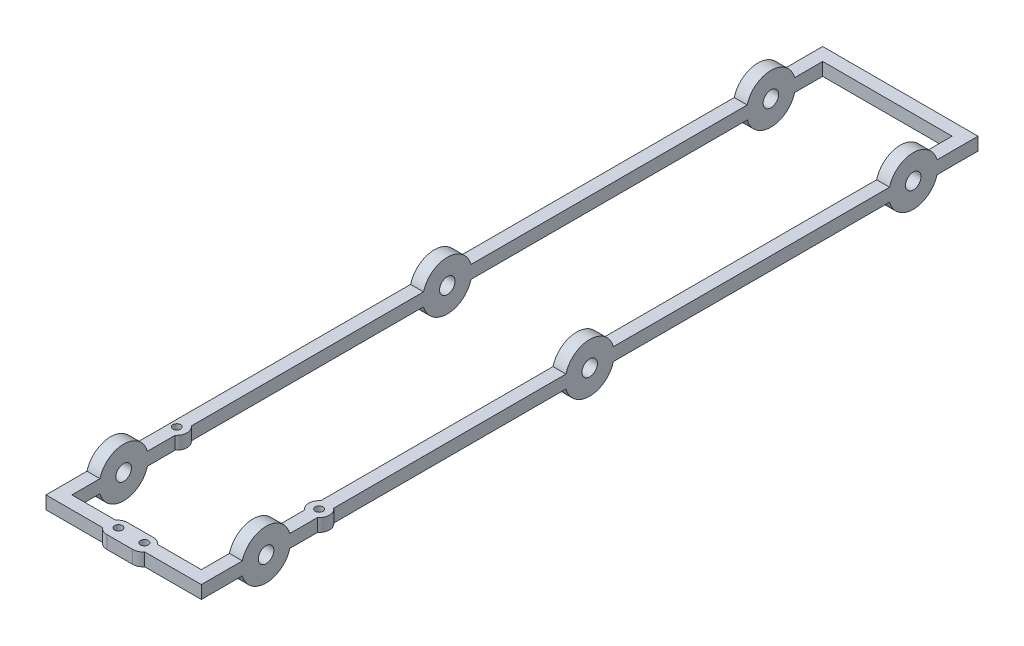
from build123d import *

# Parameters (mm, degrees)
SKETCH2_R               = 3
BOSS_EXTRUDE1_DEPTH     = 180
CUT_EXTRUDE1_DEPTH      = 351.0628515
CUT_EXTRUDE1_DEPTH_BACK = 351.0628515
SKETCH3_W               = 50
SKETCH3_H               = 290
CUT_EXTRUDE2_DEPTH      = 351.0628515
CUT_EXTRUDE2_DEPTH_BACK = 351.0628515
SKETCH5_W               = 159.12266695
SKETCH5_H               = 409.499518343
SKETCH8_R               = 4
BOSS_EXTRUDE3_DEPTH     = 5
SKETCH9_R               = 1.5
CUT_EXTRUDE4_DEPTH      = 5


with BuildPart() as part:
    # Sketch2 → Boss-Extrude1 (new body)
    with BuildSketch(Plane(origin=(0, 0, 0), x_dir=(0, 0, -1), z_dir=(1, 0, 0))):
        with BuildLine():
            Line((159.16515139, 5), (265.83484861, 5))
            ThreePointArc((265.83484861, 5), (275, 12), (284.16515139, 5))
            Line((284.16515139, 5), (300, 5))
            Line((300, 5), (300, 0))
            Line((300, 0), (284.16515139, 0))
            ThreePointArc((284.16515139, 0), (275, -7), (265.83484861, 0))
            Line((265.83484861, 0), (159.16515139, 0))
            ThreePointArc((159.16515139, 0), (150, -7), (140.83484861, 0))
            Line((140.83484861, 0), (34.16515139, 0))
            ThreePointArc((34.16515139, 0), (25, -7), (15.83484861, 0))
            Line((15.83484861, 0), (0, 0))
            Line((0, 0), (0, 5))
            Line((0, 5), (15.83484861, 5))
            ThreePointArc((15.83484861, 5), (25, 12), (34.16515139, 5))
            Line((34.16515139, 5), (140.83484861, 5))
            ThreePointArc((140.83484861, 5), (150, 12), (159.16515139, 5))
        make_face()
        with Locations(Location((150, 2.5, 0), (0, 0, 180))):
            Circle(SKETCH2_R, mode=Mode.SUBTRACT)
        with Locations(Location((275, 2.5, 0), (0, 0, 180))):
            Circle(SKETCH2_R, mode=Mode.SUBTRACT)
        with Locations(Location((25, 2.5, 0), (0, 0, 180))):
            Circle(SKETCH2_R, mode=Mode.SUBTRACT)
    extrude(amount=BOSS_EXTRUDE1_DEPTH)

    # Sketch3 → Cut-Extrude1 (cut, two sides: drawn at the far end of the back side and taken through both)
    with BuildSketch(Plane(origin=(0, 5, 0), x_dir=(1, 0, 0), z_dir=(0, 1, 0)).offset(-CUT_EXTRUDE1_DEPTH_BACK)):
        with Locations((150, 150)):
            Rectangle(SKETCH3_W, SKETCH3_H)
        with Locations((90, 150)):
            Rectangle(SKETCH3_W, SKETCH3_H)
        with Locations((30, 150)):
            Rectangle(SKETCH3_W, SKETCH3_H)
    extrude(amount=CUT_EXTRUDE1_DEPTH + CUT_EXTRUDE1_DEPTH_BACK, mode=Mode.SUBTRACT)

    # Sketch5 → Cut-Extrude2 (cut, two sides: drawn at the far end of the back side and taken through both)
    with BuildSketch(Plane(origin=(0, 5, 0), x_dir=(1, 0, 0), z_dir=(0, 1, 0)).offset(-CUT_EXTRUDE2_DEPTH_BACK)):
        with Locations((139.561333475, 139.935321467)):
            Rectangle(SKETCH5_W, SKETCH5_H)
    extrude(amount=CUT_EXTRUDE2_DEPTH + CUT_EXTRUDE2_DEPTH_BACK, mode=Mode.SUBTRACT)

    # Sketch8 → Boss-Extrude3 (add)
    with BuildSketch(Plane(origin=(0, 0, 0), x_dir=(-1, 0, 0), z_dir=(0, -1, 0))):
        with Locations((-57.5, 48)):
            Circle(SKETCH8_R)
        with BuildLine():
            Line((-25, -1.5), (-35, -1.5))
            ThreePointArc((-35, -1.5), (-39, 2.5), (-35, 6.5))
            Line((-35, 6.5), (-25, 6.5))
            ThreePointArc((-25, 6.5), (-21, 2.5), (-25, -1.5))
        make_face()
        with BuildLine():
            Line((-2.475564239, 44), (-2.475564239, 52))
            ThreePointArc((-2.475564239, 52), (-6.475564239, 48), (-2.475564239, 44))
        make_face()
    extrude(amount=-BOSS_EXTRUDE3_DEPTH)

    # Sketch9 → Cut-Extrude4 (cut)
    with BuildSketch(Plane(origin=(0, 0, 0), x_dir=(-1, 0, 0), z_dir=(0, -1, 0))):
        with Locations(Location((-25, 3, 0), (0, 0, 90))):
            Circle(SKETCH9_R)
        with Locations(Location((-35, 3, 0), (0, 0, 90))):
            Circle(SKETCH9_R)
        with Locations(Location((-57.5, 48, 0), (0, 0, 90))):
            Circle(SKETCH9_R)
        with Locations(Location((-2.5, 48, 0), (0, 0, 90))):
            Circle(SKETCH9_R)
    extrude(amount=-CUT_EXTRUDE4_DEPTH, mode=Mode.SUBTRACT)


solid = part.part
